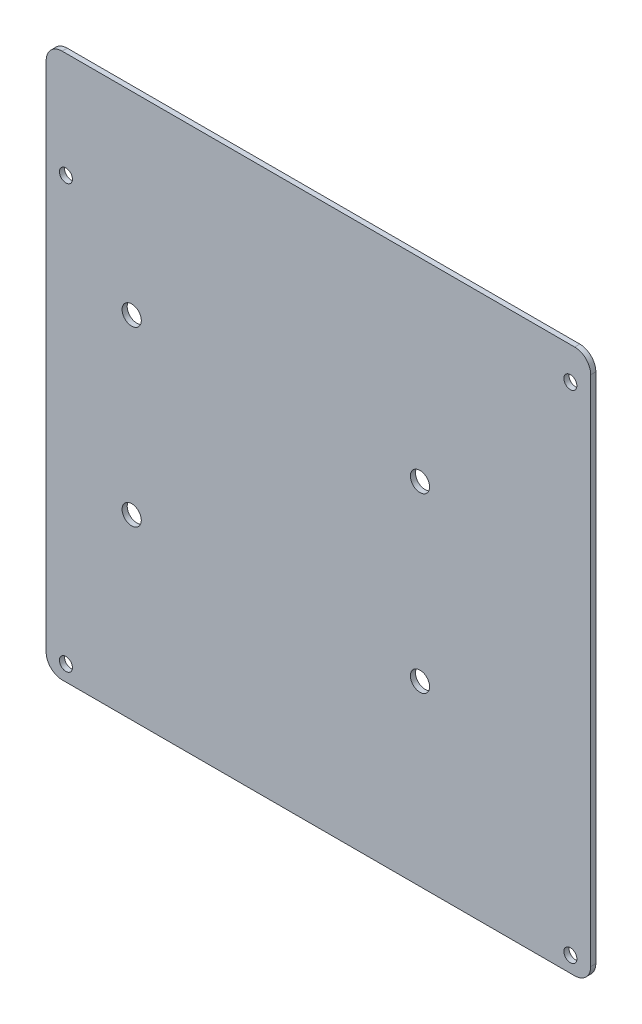
from build123d import *

# Parameters (mm, degrees)
SKETCH1_W            = 170
SKETCH1_H            = 170
BASE_DEPTH           = 1.6
ROUNDING_CORNERS_R   = 5
SKETCH2_R            = 2.03
MOUNTING_HOLES_DEPTH = 1.6
SKETCH4_R            = 3
COOLER_HOLES_DEPTH   = 1.6


with BuildPart() as part:
    # Sketch1 → Base (new body)
    with BuildSketch(Plane.XY):
        Rectangle(SKETCH1_W, SKETCH1_H)
    extrude(amount=BASE_DEPTH)

    # Rounding corners
    rounding_corners_edges = [part.edges().sort_by_distance(p)[0] for p in [
        (-85, 85, 0.8),
        (85, 85, 0.8),
        (85, -85, 0.8),
        (-85, -85, 0.8),
    ]]
    fillet(rounding_corners_edges, radius=ROUNDING_CORNERS_R)

    # Sketch2 → Mounting holes (cut)
    with BuildSketch(Plane.XY.offset(1.6)):
        with Locations((-78.83, 51.98)):
            Circle(SKETCH2_R)
        with Locations((78.65, 74.84)):
            Circle(SKETCH2_R)
        with Locations((-78.83, -80.1)):
            Circle(SKETCH2_R)
        with Locations((78.65, -80.1)):
            Circle(SKETCH2_R)
    extrude(amount=-MOUNTING_HOLES_DEPTH, mode=Mode.SUBTRACT)

    # Sketch4 → Cooler holes (cut)
    with BuildSketch(Plane.XY.offset(1.6)):
        with Locations((-58.3, 24.5)):
            Circle(SKETCH4_R)
        with Locations((31.7, 24.5)):
            Circle(SKETCH4_R)
        with Locations((31.7, -29.5)):
            Circle(SKETCH4_R)
        with Locations((-58.3, -29.5)):
            Circle(SKETCH4_R)
    extrude(amount=-COOLER_HOLES_DEPTH, mode=Mode.SUBTRACT)


solid = part.part
